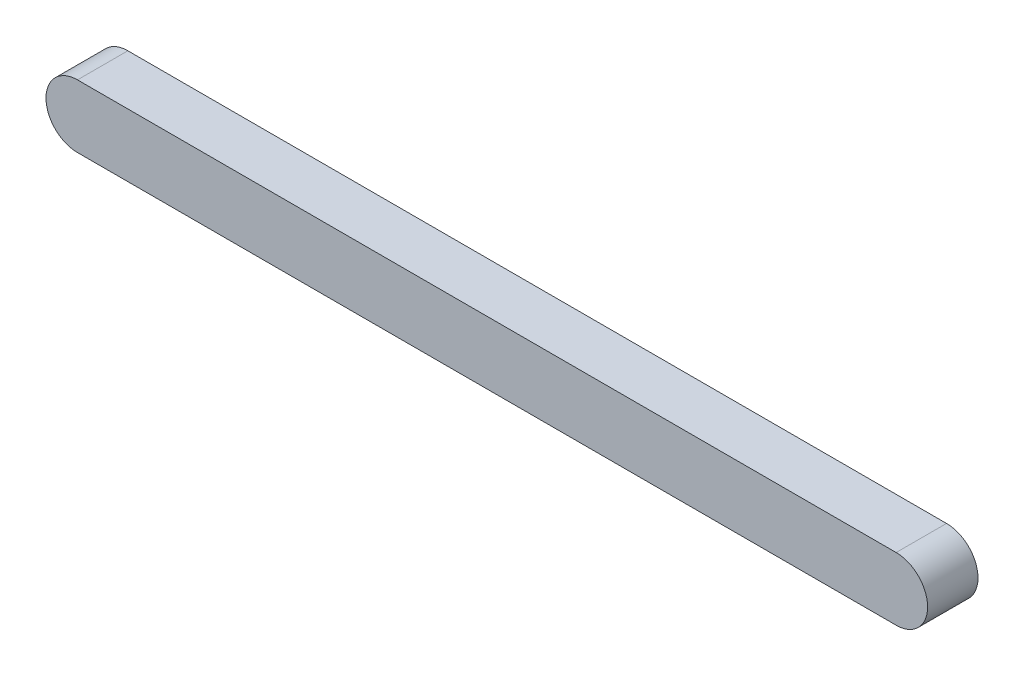
from build123d import *

# Parameters (mm, degrees)
BOSS_EXTRUDE1_DEPTH = 16


with BuildPart() as part:
    # Sketch1 → Boss-Extrude1 (new body)
    with BuildSketch(Plane.XY):
        with BuildLine():
            Line((-110.432989691, 15.81443299), (149.567010309, 15.81443299))
            ThreePointArc((149.567010309, 15.81443299), (159.567010309, 5.81443299), (149.567010309, -4.18556701))
            Line((149.567010309, -4.18556701), (-110.432989691, -4.18556701))
            ThreePointArc((-110.432989691, -4.18556701), (-120.432989691, 5.81443299), (-110.432989691, 15.81443299))
        make_face()
    extrude(amount=BOSS_EXTRUDE1_DEPTH)


solid = part.part
